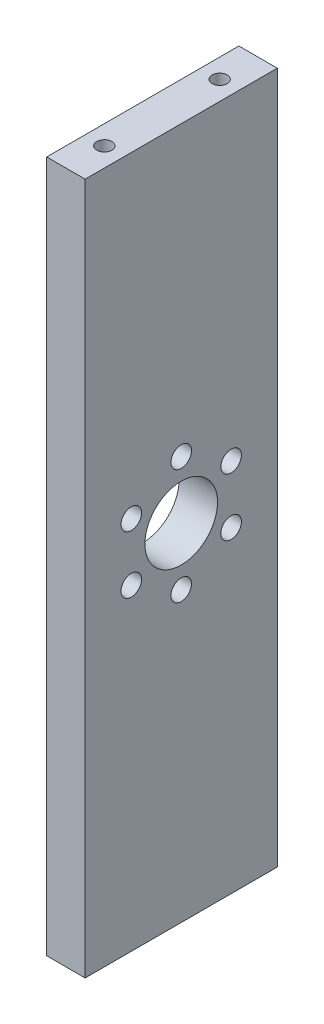
from build123d import *

# Parameters (mm, degrees)
SKETCH1_W                      = 31.75
SKETCH1_H                      = 114.3
BOSS_EXTRUDE1_DEPTH            = 3.175
M3X0_5_TAPPED_HOLE1_AT_2_COUNT = 2
M3X0_5_TAPPED_HOLE1_AT_2_PITCH = 19.05
F_12_0MM_DOWEL_HOLE1_D         = 12
CBORE_FOR_M3_SHCS1_D           = 3.4
CBORE_FOR_M3_SHCS1_DEPTH       = 11.678536948
CBORE_FOR_M3_SHCS1_CBORE_D     = 4.5
CBORE_FOR_M3_SHCS1_CBORE_DEPTH = 2
CBORE_FOR_M3_SHCS1_TIP         = 1.021463052


with BuildPart() as part:
    # Sketch1 → Boss-Extrude1 (new, symmetric)
    with BuildSketch(Plane(origin=(0, 0, 0), x_dir=(0, 0, -1), z_dir=(1, 0, 0))):
        Rectangle(SKETCH1_W, SKETCH1_H)
    extrude(amount=BOSS_EXTRUDE1_DEPTH, both=True)

    # Sketch5 → M3x0.5 Tapped Hole1 (revolve, cut)
    with BuildSketch(Plane(origin=(0, 57.15, -9.525), x_dir=(0, 0, 1), z_dir=(1, 0, 0))):
        Polygon((0, 0), (0, 13.451075774), (1.25, 12.7), (1.25, 0), align=None)
    m3x0_5_tapped_hole1 = revolve(axis=Axis((0, 63.5, -9.525), (0, -1, 0)), mode=Mode.SUBTRACT)

    # M3x0.5 Tapped Hole1 at 2: M3x0.5 Tapped Hole1 ×2
    with Locations(*[(0, 0, i * M3X0_5_TAPPED_HOLE1_AT_2_PITCH) for i in range(1, M3X0_5_TAPPED_HOLE1_AT_2_COUNT)]):
        add(m3x0_5_tapped_hole1, mode=Mode.SUBTRACT)

    # Mirror1: M3x0.5 Tapped Hole1 across plane
    add(m3x0_5_tapped_hole1.mirror(Plane.ZX), mode=Mode.SUBTRACT)

    # Mirror1 copy 1 sketch → Mirror1 copy 1 (revolve, cut)
    with BuildSketch(Plane(origin=(0, -57.15, 9.525), x_dir=(0, 0, 1), z_dir=(1, 0, 0))):
        Polygon((0, 0), (0, -13.451075774), (1.25, -12.7), (1.25, 0), align=None)
    revolve(axis=Axis((0, -63.5, 9.525), (0, -1, 0)), mode=Mode.SUBTRACT)

    # Ø12.0mm Dowel Hole1 (through all)
    with Locations(Plane.ZY.offset(3.175)):
        with Locations((0, 0)):
            Hole(F_12_0MM_DOWEL_HOLE1_D / 2)

    # CBORE for M3 SHCS1
    with Locations(Plane.ZY.offset(3.175)):
        with Locations((8.248891971, -4.7625), (8.248891971, 4.7625), (0, 9.525), (-8.248891971, 4.7625), (-8.248891971, -4.7625), (0, -9.525)):
            CounterBoreHole(CBORE_FOR_M3_SHCS1_D / 2, CBORE_FOR_M3_SHCS1_CBORE_D / 2, CBORE_FOR_M3_SHCS1_CBORE_DEPTH, depth=CBORE_FOR_M3_SHCS1_DEPTH)
            with Locations((0, 0, -(CBORE_FOR_M3_SHCS1_DEPTH + CBORE_FOR_M3_SHCS1_TIP / 2))):  # 118° drill point
                Cone(0, CBORE_FOR_M3_SHCS1_D / 2, CBORE_FOR_M3_SHCS1_TIP, mode=Mode.SUBTRACT)


solid = part.part
